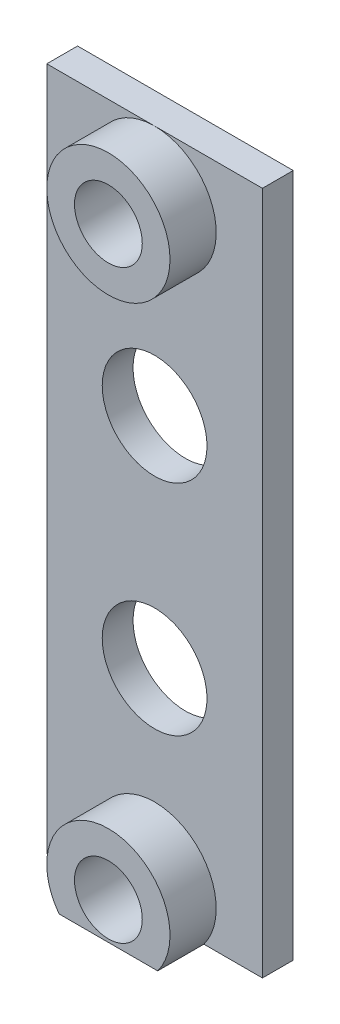
from build123d import *

# Parameters (mm, degrees)
RETAINER_PLATE_START            = 34.5
SKETCH1_W                       = 7
SKETCH1_H                       = 23
RETAINER_PLATE_DEPTH            = 1
RETAINER_MOUNTING_SPACERS_START = 35.5
SKETCH2_R                       = 2
RETAINER_MOUNTING_SPACERS_DEPTH = 1.5
RETAINER_CLEARANCE_HOLES_START  = 34
SKETCH3_R                       = 1.7
SKETCH3_R_2                     = 1.1
RETAINER_CLEARANCE_HOLES_DEPTH  = 4
CLEAR_END_WALL_START            = 33
SKETCH4_W                       = 15
SKETCH4_H                       = 6.3
CLEAR_END_WALL_DEPTH            = 6


with BuildPart() as part:
    # Sketch1 → Retainer_plate (new body)
    with BuildSketch(Plane.XY.offset(RETAINER_PLATE_START)):
        with Locations((-32.018684277, -38)):
            Rectangle(SKETCH1_W, SKETCH1_H)
    extrude(amount=RETAINER_PLATE_DEPTH)

    # Sketch2 → Retainer_mounting_spacers (add)
    with BuildSketch(Plane.XY.offset(RETAINER_MOUNTING_SPACERS_START)):
        with Locations(Location((-32.018684277, -47.5, 0), (0, 0, 270))):
            Circle(SKETCH2_R)
        with Locations(Location((-32.018684277, -28.5, 0), (0, 0, 90))):
            Circle(SKETCH2_R)
    extrude(amount=RETAINER_MOUNTING_SPACERS_DEPTH)

    # Sketch3 → Retainer_clearance_holes (cut)
    with BuildSketch(Plane.XY.offset(RETAINER_CLEARANCE_HOLES_START)):
        with Locations(Location((-32.018684277, -41.745416557, 0), (0, 0, 180))):
            Circle(SKETCH3_R)
        with Locations(Location((-32.018684277, -34.643402341, 0), (0, 0, 180))):
            Circle(SKETCH3_R)
        with Locations(Location((-32.018684277, -47.5, 0), (0, 0, 180))):
            Circle(SKETCH3_R_2)
        with Locations(Location((-32.018684277, -28.5, 0), (0, 0, 180))):
            Circle(SKETCH3_R_2)
    extrude(amount=RETAINER_CLEARANCE_HOLES_DEPTH, mode=Mode.SUBTRACT)

    # Sketch4 → Clear_end_wall (cut)
    with BuildSketch(Plane.XY.offset(CLEAR_END_WALL_START)):
        with Locations((-32.5, -51.85)):
            Rectangle(SKETCH4_W, SKETCH4_H)
    extrude(amount=CLEAR_END_WALL_DEPTH, mode=Mode.SUBTRACT)


solid = part.part
